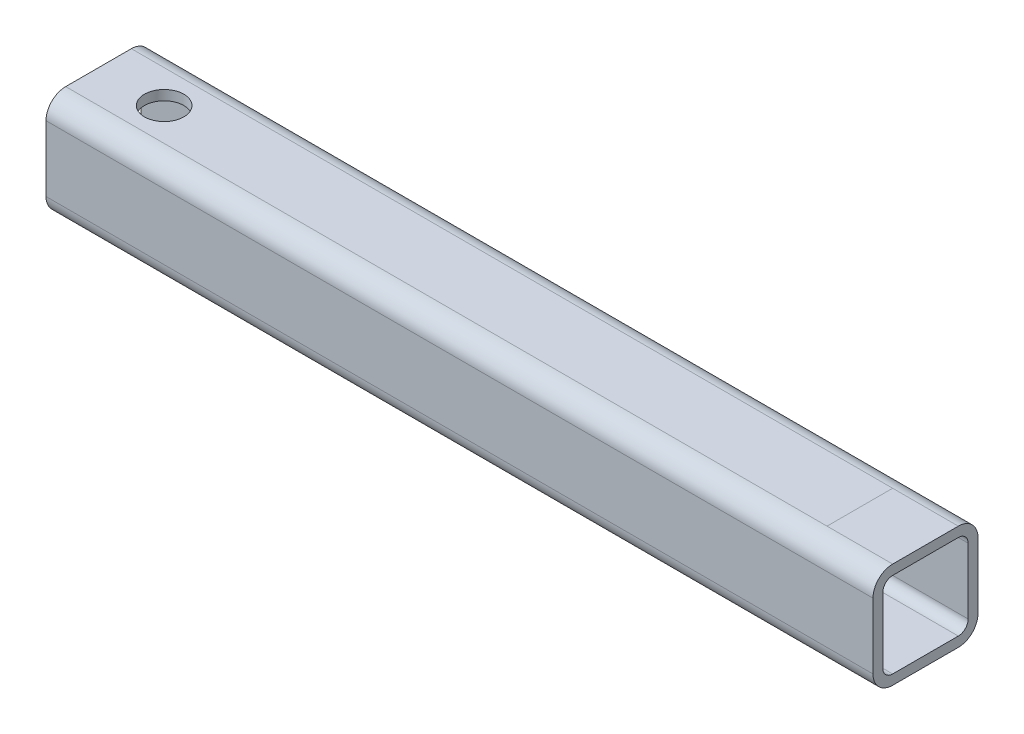
from build123d import *

# Parameters (mm, degrees)
TUBE_SQUARE_TS2X2X0_1875_1_DEPTH = 400
SKETCH12_R                       = 9.525
CUT_EXTRUDE1_DEPTH               = 405.012128531


with BuildPart() as part:
    # Sketch11 → Tube square TS2X2X0.1875(1) (new body)
    with BuildSketch(Plane.YZ):
        with BuildLine():
            Line((-15.875, -25.4), (15.875, -25.4))
            ThreePointArc((15.875, -25.4), (22.610192091, -22.610192091), (25.4, -15.875))
            Line((25.4, -15.875), (25.4, 15.875))
            ThreePointArc((25.4, 15.875), (22.610192091, 22.610192091), (15.875, 25.4))
            Line((15.875, 25.4), (-15.875, 25.4))
            ThreePointArc((-15.875, 25.4), (-22.610192091, 22.610192091), (-25.4, 15.875))
            Line((-25.4, 15.875), (-25.4, -15.875))
            ThreePointArc((-25.4, -15.875), (-22.610192091, -22.610192091), (-15.875, -25.4))
        make_face()
        with BuildLine():
            Line((-15.875, -20.6375), (15.875, -20.6375))
            ThreePointArc((15.875, -20.6375), (19.242596045, -19.242596045), (20.6375, -15.875))
            Line((20.6375, -15.875), (20.6375, 15.875))
            ThreePointArc((20.6375, 15.875), (19.242596045, 19.242596045), (15.875, 20.6375))
            Line((15.875, 20.6375), (-15.875, 20.6375))
            ThreePointArc((-15.875, 20.6375), (-19.242596045, 19.242596045), (-20.6375, 15.875))
            Line((-20.6375, 15.875), (-20.6375, -15.875))
            ThreePointArc((-20.6375, -15.875), (-19.242596045, -19.242596045), (-15.875, -20.6375))
        make_face(mode=Mode.SUBTRACT)
    extrude(amount=TUBE_SQUARE_TS2X2X0_1875_1_DEPTH)

    # Sketch12 → Cut-Extrude1 (cut, through all)
    with BuildSketch(Plane(origin=(0, 25.4, 0), x_dir=(1, 0, 0), z_dir=(0, 1, 0))):
        with Locations(Location((31.75, 0, 0), (0, 0, 270))):
            Circle(SKETCH12_R)
    extrude(amount=-CUT_EXTRUDE1_DEPTH, mode=Mode.SUBTRACT)


solid = part.part
